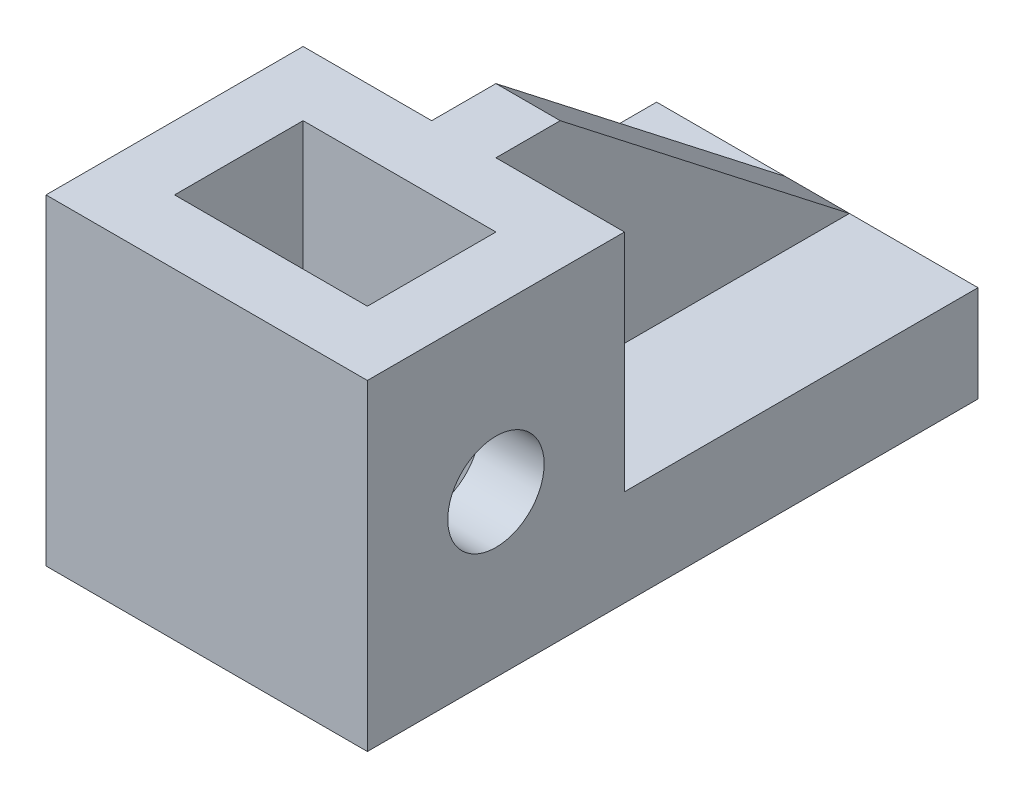
from build123d import *

# Parameters (mm, degrees)
SKETCH2_R               = 7.5
BOSS_EXTRUDE1_DEPTH     = 25
CUT_EXTRUDE1_DEPTH      = 111.227038425
CUT_EXTRUDE1_DEPTH_BACK = 40
SKETCH3_W               = 30
SKETCH3_H               = 20
SKETCH4_W               = 10
SKETCH4_H               = 10
BOSS_EXTRUDE2_DEPTH     = 40
RIB36_REACH             = 112.227
SKETCH12_WALL_W         = 279.462848106
SKETCH12_WALL_H         = 10


with BuildPart() as part:
    # Sketch2 → Boss-Extrude1 (new, symmetric)
    with BuildSketch(Plane(origin=(0, 0, 0), x_dir=(0, 0, -1), z_dir=(1, 0, 0))):
        Polygon((0, 50), (40, 50), (40, 15), (95, 15), (95, 0), (0, 0), align=None)
        with Locations((20, 25)):
            Circle(SKETCH2_R, mode=Mode.SUBTRACT)
    extrude(amount=BOSS_EXTRUDE1_DEPTH, both=True)

    # Sketch3 → Cut-Extrude1 (cut, two sides: drawn at the far end of the back side and taken through both)
    with BuildSketch(Plane(origin=(0, 50, 0), x_dir=(1, 0, 0), z_dir=(0, 1, 0)).offset(-CUT_EXTRUDE1_DEPTH_BACK)):
        with Locations((0, 20)):
            Rectangle(SKETCH3_W, SKETCH3_H)
    extrude(amount=CUT_EXTRUDE1_DEPTH + CUT_EXTRUDE1_DEPTH_BACK, mode=Mode.SUBTRACT)

    # Sketch4 → Boss-Extrude2 (add)
    with BuildSketch(Plane(origin=(0, 50, 0), x_dir=(1, 0, 0), z_dir=(0, 1, 0))):
        with Locations((0, 45)):
            Rectangle(SKETCH4_W, SKETCH4_H)
    extrude(amount=-BOSS_EXTRUDE2_DEPTH)

    # Sketch12 wall → Rib36 (add, up to next)
    with BuildSketch(Plane(origin=(0, 32.5, -72.5), x_dir=(0, -0.613940613515, -0.789352217376), z_dir=(0, 0.789352217376, -0.613940613515)), mode=Mode.PRIVATE) as rib36_sk1:
        Rectangle(SKETCH12_WALL_W, SKETCH12_WALL_H)
    rib36_tool1 = extrude(rib36_sk1.sketch, amount=-RIB36_REACH, mode=Mode.PRIVATE) - part.part
    add(rib36_tool1.solids().sort_by_distance((0, 32.5, -72.5))[0])


solid = part.part
